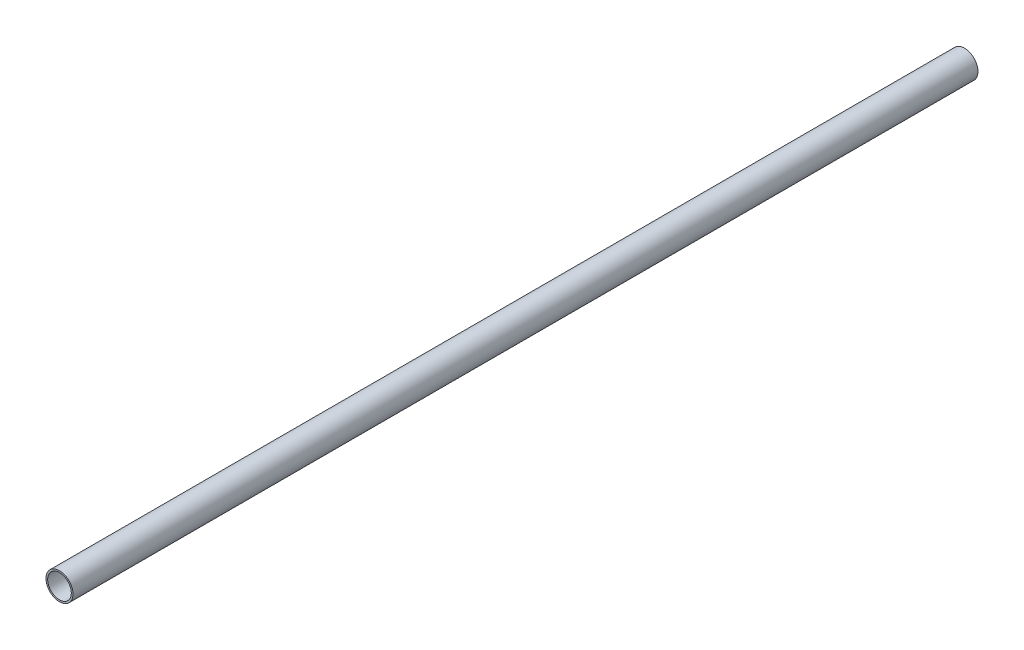
from build123d import *

# Parameters (mm, degrees)
SKETCH1_R               = 12.7
SKETCH1_R_2             = 11.1125
BOSS_EXTRUDE1_DEPTH     = 914.4
CUT_EXTRUDE1_DEPTH      = 19.05
CUT_EXTRUDE1_DEPTH_BACK = 19.05
SKETCH2_W               = 25.4
SKETCH2_H               = 63.5


with BuildPart() as part:
    # Sketch1 → Boss-Extrude1 (new body)
    with BuildSketch(Plane.XY):
        Circle(SKETCH1_R)
        Circle(SKETCH1_R_2, mode=Mode.SUBTRACT)
    extrude(amount=BOSS_EXTRUDE1_DEPTH)

    # Sketch2 → Cut-Extrude1 (cut, two sides: drawn at the far end of the back side and taken through both)
    with BuildSketch(Plane(origin=(0, 0, 0), x_dir=(1, 0, 0), z_dir=(0, 1, 0)).offset(-CUT_EXTRUDE1_DEPTH_BACK)):
        with Locations((0, -882.65)):
            Rectangle(SKETCH2_W, SKETCH2_H)
    extrude(amount=CUT_EXTRUDE1_DEPTH + CUT_EXTRUDE1_DEPTH_BACK, mode=Mode.SUBTRACT)


solid = part.part
